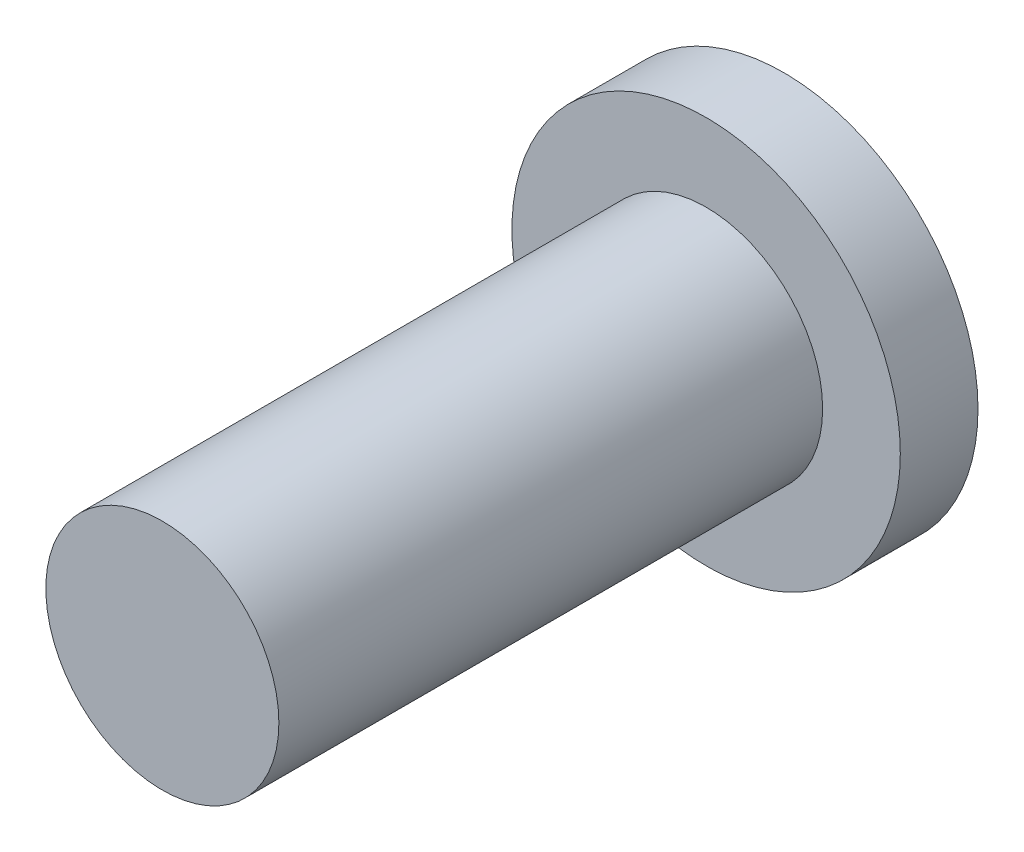
from build123d import *

# Parameters (mm, degrees)
SKETCH1_R           = 12.5
SKETCH1_R_2         = 7.5
BOSS_EXTRUDE1_DEPTH = 5
SKETCH1_2_R         = 7.5
BOSS_EXTRUDE2_DEPTH = 40


with BuildPart() as part:
    # Sketch1 → Boss-Extrude1 (new body)
    with BuildSketch(Plane.XY):
        Circle(SKETCH1_R)
        Circle(SKETCH1_R_2, mode=Mode.SUBTRACT)
    extrude(amount=BOSS_EXTRUDE1_DEPTH)

    # Sketch1<2> → Boss-Extrude2 (add)
    with BuildSketch(Plane.XY):
        Circle(SKETCH1_2_R)
    extrude(amount=BOSS_EXTRUDE2_DEPTH)


solid = part.part
